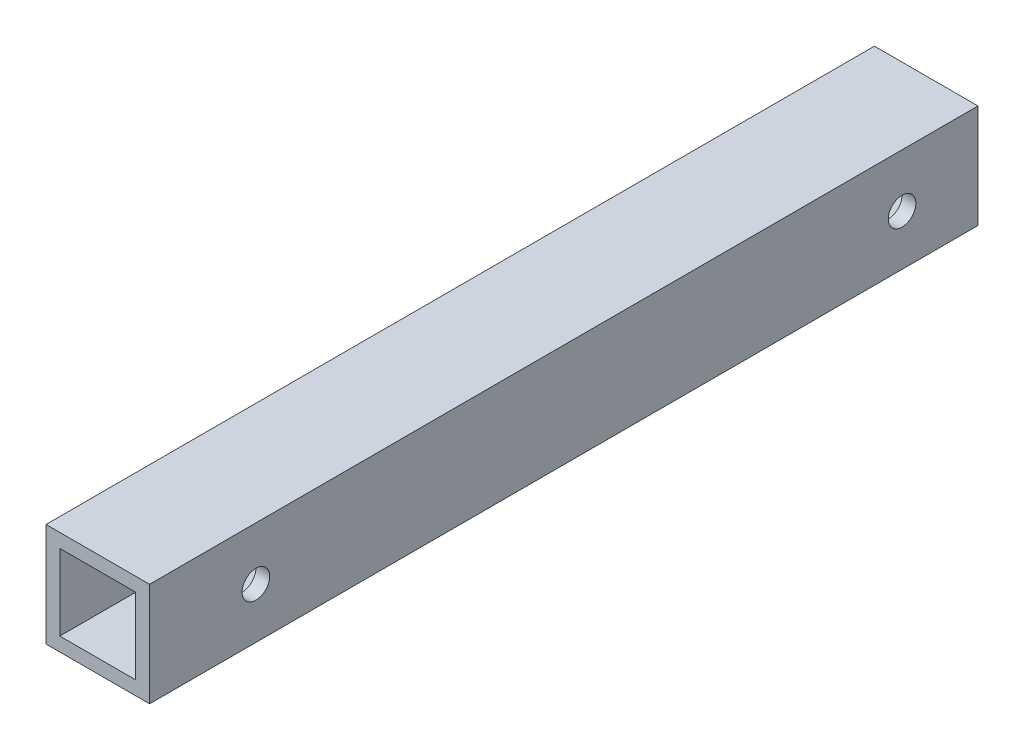
from build123d import *

# Parameters (mm, degrees)
SKETCH1_W               = 15
SKETCH1_H               = 15
SKETCH1_W_2             = 11
SKETCH1_H_2             = 11
BOSS_EXTRUDE1_DEPTH     = 60
CUT_EXTRUDE1_DEPTH      = 63.299678972
CUT_EXTRUDE1_DEPTH_BACK = 63.299678972
SKETCH2_R               = 2


with BuildPart() as part:
    # Sketch1 → Boss-Extrude1 (new, symmetric)
    with BuildSketch(Plane.XY):
        Rectangle(SKETCH1_W, SKETCH1_H)
        Rectangle(SKETCH1_W_2, SKETCH1_H_2, mode=Mode.SUBTRACT)
    extrude(amount=BOSS_EXTRUDE1_DEPTH, both=True)

    # Sketch2 → Cut-Extrude1 (cut, two sides: drawn at the far end of the back side and taken through both)
    with BuildSketch(Plane(origin=(7.5, 0, 0), x_dir=(0, 0, -1), z_dir=(1, 0, 0)).offset(-CUT_EXTRUDE1_DEPTH_BACK)):
        with Locations((-44.599061213, -0.2)):
            Circle(SKETCH2_R)
        with Locations((49, -0.2)):
            Circle(SKETCH2_R)
    extrude(amount=CUT_EXTRUDE1_DEPTH + CUT_EXTRUDE1_DEPTH_BACK, mode=Mode.SUBTRACT)


solid = part.part
